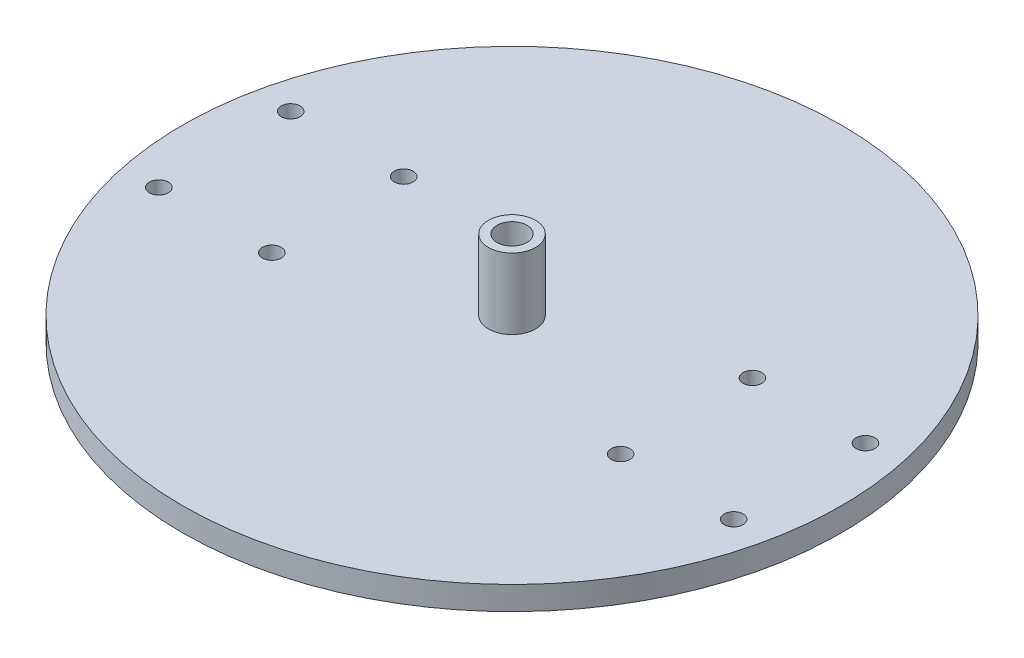
from build123d import *

# Parameters (mm, degrees)
SKETCH1_R           = 70
SKETCH1_R_2         = 3.175
BOSS_EXTRUDE2_DEPTH = 5
SKETCH2_R           = 5
SKETCH2_R_2         = 3.175
BOSS_EXTRUDE4_DEPTH = 15
SKETCH5_R           = 2
CUT_EXTRUDE4_DEPTH  = 101.124921973


with BuildPart() as part:
    # Sketch1 → Boss-Extrude2 (new body)
    with BuildSketch(Plane(origin=(0, 0, 0), x_dir=(1, 0, 0), z_dir=(0, 1, 0))):
        with Locations(Location((0, 0, 0), (0, 0, 270))):
            Circle(SKETCH1_R)
        with Locations(Location((0, 0, 0), (0, 0, 270))):
            Circle(SKETCH1_R_2, mode=Mode.SUBTRACT)
    extrude(amount=BOSS_EXTRUDE2_DEPTH)

    # Sketch2 → Boss-Extrude4 (add)
    with BuildSketch(Plane(origin=(0, 5, 0), x_dir=(1, 0, 0), z_dir=(0, 1, 0))):
        with Locations(Location((0, 0, 0), (0, 0, 270))):
            Circle(SKETCH2_R)
        with Locations(Location((0, 0, 0), (0, 0, 270))):
            Circle(SKETCH2_R_2, mode=Mode.SUBTRACT)
    extrude(amount=BOSS_EXTRUDE4_DEPTH)

    # Sketch5 → Cut-Extrude4 (cut, through all)
    with BuildSketch(Plane(origin=(0, 5, 0), x_dir=(1, 0, 0), z_dir=(0, 1, 0))):
        with Locations(Location((-61.041759509, 14.033218695, 0), (0, 0, 270))):
            Circle(SKETCH5_R)
        with Locations(Location((-37.041759509, 14.033218695, 0), (0, 0, 270))):
            Circle(SKETCH5_R)
        with Locations(Location((-61.041759509, -13.966781305, 0), (0, 0, 270))):
            Circle(SKETCH5_R)
        with Locations(Location((-37.041759509, -13.966781305, 0), (0, 0, 270))):
            Circle(SKETCH5_R)
        with Locations(Location((37.041759509, 14.033218695, 0), (0, 0, 270))):
            Circle(SKETCH5_R)
        with Locations(Location((61.041759509, 14.033218695, 0), (0, 0, 270))):
            Circle(SKETCH5_R)
        with Locations(Location((37.041759509, -13.966781305, 0), (0, 0, 270))):
            Circle(SKETCH5_R)
        with Locations(Location((61.041759509, -13.966781305, 0), (0, 0, 270))):
            Circle(SKETCH5_R)
    extrude(amount=-CUT_EXTRUDE4_DEPTH, mode=Mode.SUBTRACT)


solid = part.part
